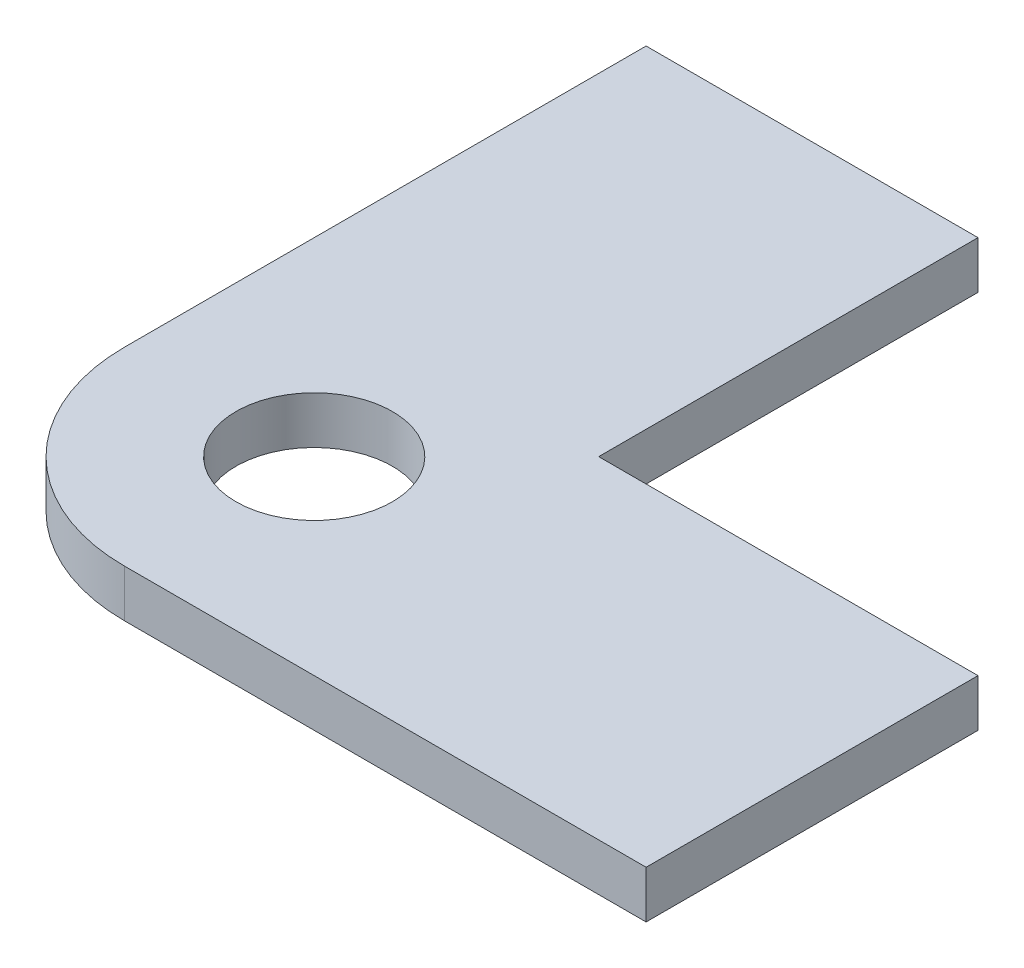
from build123d import *

# Parameters (mm, degrees)
SKETCH1_R           = 1.65
BOSS_EXTRUDE1_DEPTH = 1


with BuildPart() as part:
    # Sketch1 → Boss-Extrude1 (new body)
    with BuildSketch(Plane(origin=(0, 0, 0), x_dir=(1, 0, 0), z_dir=(0, 1, 0))):
        with BuildLine():
            Line((11, -3.99967418), (11, 3))
            Line((11, 3), (3, 3))
            Line((3, 3), (3, 11))
            Line((3, 11), (-3.99967418, 11))
            Line((-3.99967418, 11), (-3.99967418, 0))
            ThreePointArc((-3.99967418, 0), (-2.828196736, -2.828196736), (0, -3.99967418))
            Line((0, -3.99967418), (11, -3.99967418))
        make_face()
        with Locations(Location((0, 0, 0), (0, 0, 270))):
            Circle(SKETCH1_R, mode=Mode.SUBTRACT)
    extrude(amount=BOSS_EXTRUDE1_DEPTH)


solid = part.part
